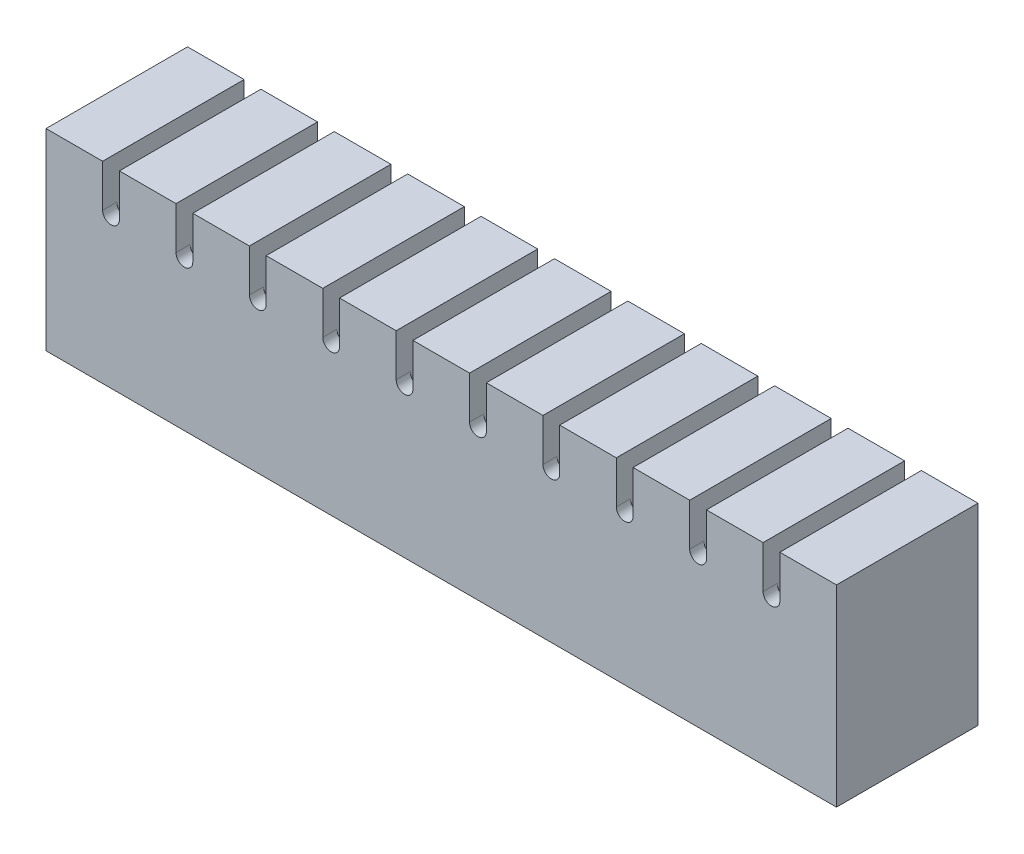
from build123d import *

# Parameters (mm, degrees)
SKIZZE1_W                       = 55.85
SKIZZE1_H                       = 2
AUFSATZ_LINEAR_AUSTRAGEN1_DEPTH = 5
SKIZZE2_W                       = 4
SKIZZE2_H                       = 11.6
AUFSATZ_LINEAR_AUSTRAGEN2_DEPTH = 5
LINEARES_MUSTER1_COUNT          = 11
LINEARES_MUSTER1_PITCH          = 5.185
AUFSATZ_LINEAR_AUSTRAGEN3_DEPTH = 1
LINEARES_MUSTER2_COUNT          = 10
LINEARES_MUSTER2_PITCH          = 5.185
LINEARES_MUSTER2_COPY_1_DEPTH   = 1
LINEARES_MUSTER2_COPY_2_DEPTH   = 1
LINEARES_MUSTER2_COPY_3_DEPTH   = 1
LINEARES_MUSTER2_COPY_4_DEPTH   = 1
LINEARES_MUSTER2_COPY_5_DEPTH   = 1
LINEARES_MUSTER2_COPY_6_DEPTH   = 1
LINEARES_MUSTER2_COPY_7_DEPTH   = 1
LINEARES_MUSTER2_COPY_8_DEPTH   = 1
LINEARES_MUSTER2_COPY_9_DEPTH   = 1


with BuildPart() as part:
    # Skizze1 → Aufsatz-Linear austragen1 (new, symmetric)
    with BuildSketch(Plane.XY):
        with Locations((27.925, -1)):
            Rectangle(SKIZZE1_W, SKIZZE1_H)
    extrude(amount=AUFSATZ_LINEAR_AUSTRAGEN1_DEPTH, both=True)

    # Skizze2 → Aufsatz-Linear austragen2 (add, symmetric)
    with BuildSketch(Plane.XY):
        with Locations((2, 5.8)):
            Rectangle(SKIZZE2_W, SKIZZE2_H)
    aufsatz_linear_austragen2 = extrude(amount=AUFSATZ_LINEAR_AUSTRAGEN2_DEPTH, both=True)

    # Lineares Muster1: Aufsatz-Linear austragen2 ×11
    with Locations(*[(i * LINEARES_MUSTER1_PITCH, 0, 0) for i in range(1, LINEARES_MUSTER1_COUNT)]):
        add(aufsatz_linear_austragen2)

    # Skizze3 → Aufsatz-Linear austragen3 (add)
    with BuildSketch(Plane.XY.offset(5)):
        with BuildLine():
            Line((4, 8.6), (4, 0))
            Line((4, 0), (5.185, 0))
            Line((5.185, 0), (5.185, 8.6))
            ThreePointArc((5.185, 8.6), (4.5925, 8.0075), (4, 8.6))
        make_face()
    aufsatz_linear_austragen3 = extrude(amount=-AUFSATZ_LINEAR_AUSTRAGEN3_DEPTH)

    # Spiegeln1: Aufsatz-Linear austragen3 across plane
    add(aufsatz_linear_austragen3.mirror(Plane.XY))

    # Lineares Muster2: Aufsatz-Linear austragen3 ×10
    with Locations(*[(i * LINEARES_MUSTER2_PITCH, 0, 0) for i in range(1, LINEARES_MUSTER2_COUNT)]):
        add(aufsatz_linear_austragen3)

    # Lineares Muster2 copy 1 sketch → Lineares Muster2 copy 1 (add)
    with BuildSketch(Plane(origin=(5.185, 0, -5), x_dir=(1, 0, 0), z_dir=(0, 0, -1))):
        with BuildLine():
            Line((4, -8.6), (4, 0))
            Line((4, 0), (5.185, 0))
            Line((5.185, 0), (5.185, -8.6))
            ThreePointArc((5.185, -8.6), (4.5925, -8.0075), (4, -8.6))
        make_face()
    extrude(amount=-LINEARES_MUSTER2_COPY_1_DEPTH)

    # Lineares Muster2 copy 2 sketch → Lineares Muster2 copy 2 (add)
    with BuildSketch(Plane(origin=(10.37, 0, -5), x_dir=(1, 0, 0), z_dir=(0, 0, -1))):
        with BuildLine():
            Line((4, -8.6), (4, 0))
            Line((4, 0), (5.185, 0))
            Line((5.185, 0), (5.185, -8.6))
            ThreePointArc((5.185, -8.6), (4.5925, -8.0075), (4, -8.6))
        make_face()
    extrude(amount=-LINEARES_MUSTER2_COPY_2_DEPTH)

    # Lineares Muster2 copy 3 sketch → Lineares Muster2 copy 3 (add)
    with BuildSketch(Plane(origin=(15.555, 0, -5), x_dir=(1, 0, 0), z_dir=(0, 0, -1))):
        with BuildLine():
            Line((4, -8.6), (4, 0))
            Line((4, 0), (5.185, 0))
            Line((5.185, 0), (5.185, -8.6))
            ThreePointArc((5.185, -8.6), (4.5925, -8.0075), (4, -8.6))
        make_face()
    extrude(amount=-LINEARES_MUSTER2_COPY_3_DEPTH)

    # Lineares Muster2 copy 4 sketch → Lineares Muster2 copy 4 (add)
    with BuildSketch(Plane(origin=(20.74, 0, -5), x_dir=(1, 0, 0), z_dir=(0, 0, -1))):
        with BuildLine():
            Line((4, -8.6), (4, 0))
            Line((4, 0), (5.185, 0))
            Line((5.185, 0), (5.185, -8.6))
            ThreePointArc((5.185, -8.6), (4.5925, -8.0075), (4, -8.6))
        make_face()
    extrude(amount=-LINEARES_MUSTER2_COPY_4_DEPTH)

    # Lineares Muster2 copy 5 sketch → Lineares Muster2 copy 5 (add)
    with BuildSketch(Plane(origin=(25.925, 0, -5), x_dir=(1, 0, 0), z_dir=(0, 0, -1))):
        with BuildLine():
            Line((4, -8.6), (4, 0))
            Line((4, 0), (5.185, 0))
            Line((5.185, 0), (5.185, -8.6))
            ThreePointArc((5.185, -8.6), (4.5925, -8.0075), (4, -8.6))
        make_face()
    extrude(amount=-LINEARES_MUSTER2_COPY_5_DEPTH)

    # Lineares Muster2 copy 6 sketch → Lineares Muster2 copy 6 (add)
    with BuildSketch(Plane(origin=(31.11, 0, -5), x_dir=(1, 0, 0), z_dir=(0, 0, -1))):
        with BuildLine():
            Line((4, -8.6), (4, 0))
            Line((4, 0), (5.185, 0))
            Line((5.185, 0), (5.185, -8.6))
            ThreePointArc((5.185, -8.6), (4.5925, -8.0075), (4, -8.6))
        make_face()
    extrude(amount=-LINEARES_MUSTER2_COPY_6_DEPTH)

    # Lineares Muster2 copy 7 sketch → Lineares Muster2 copy 7 (add)
    with BuildSketch(Plane(origin=(36.295, 0, -5), x_dir=(1, 0, 0), z_dir=(0, 0, -1))):
        with BuildLine():
            Line((4, -8.6), (4, 0))
            Line((4, 0), (5.185, 0))
            Line((5.185, 0), (5.185, -8.6))
            ThreePointArc((5.185, -8.6), (4.5925, -8.0075), (4, -8.6))
        make_face()
    extrude(amount=-LINEARES_MUSTER2_COPY_7_DEPTH)

    # Lineares Muster2 copy 8 sketch → Lineares Muster2 copy 8 (add)
    with BuildSketch(Plane(origin=(41.48, 0, -5), x_dir=(1, 0, 0), z_dir=(0, 0, -1))):
        with BuildLine():
            Line((4, -8.6), (4, 0))
            Line((4, 0), (5.185, 0))
            Line((5.185, 0), (5.185, -8.6))
            ThreePointArc((5.185, -8.6), (4.5925, -8.0075), (4, -8.6))
        make_face()
    extrude(amount=-LINEARES_MUSTER2_COPY_8_DEPTH)

    # Lineares Muster2 copy 9 sketch → Lineares Muster2 copy 9 (add)
    with BuildSketch(Plane(origin=(46.665, 0, -5), x_dir=(1, 0, 0), z_dir=(0, 0, -1))):
        with BuildLine():
            Line((4, -8.6), (4, 0))
            Line((4, 0), (5.185, 0))
            Line((5.185, 0), (5.185, -8.6))
            ThreePointArc((5.185, -8.6), (4.5925, -8.0075), (4, -8.6))
        make_face()
    extrude(amount=-LINEARES_MUSTER2_COPY_9_DEPTH)


solid = part.part
